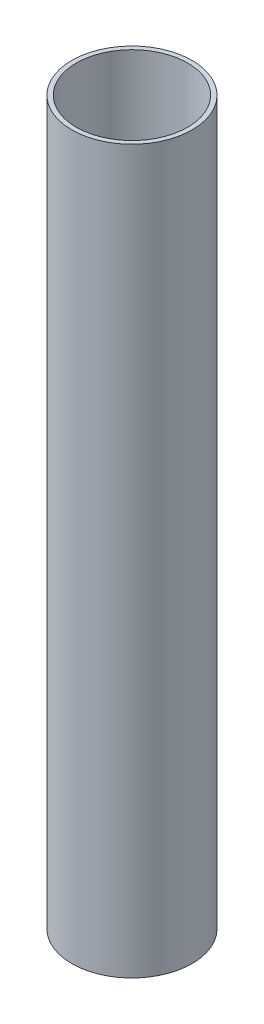
from build123d import *

# Parameters (mm, degrees)
SKETCH1_R           = 9.525
SKETCH1_R_2         = 8.8138
BOSS_EXTRUDE1_DEPTH = 114.3


with BuildPart() as part:
    # Sketch1 → Boss-Extrude1 (new body)
    with BuildSketch(Plane(origin=(0, 0, 0), x_dir=(1, 0, 0), z_dir=(0, 1, 0))):
        with Locations(Location((0, 0, 0), (0, 0, 270))):
            Circle(SKETCH1_R)
        with Locations(Location((0, 0, 0), (0, 0, 270))):
            Circle(SKETCH1_R_2, mode=Mode.SUBTRACT)
    extrude(amount=BOSS_EXTRUDE1_DEPTH)


solid = part.part
